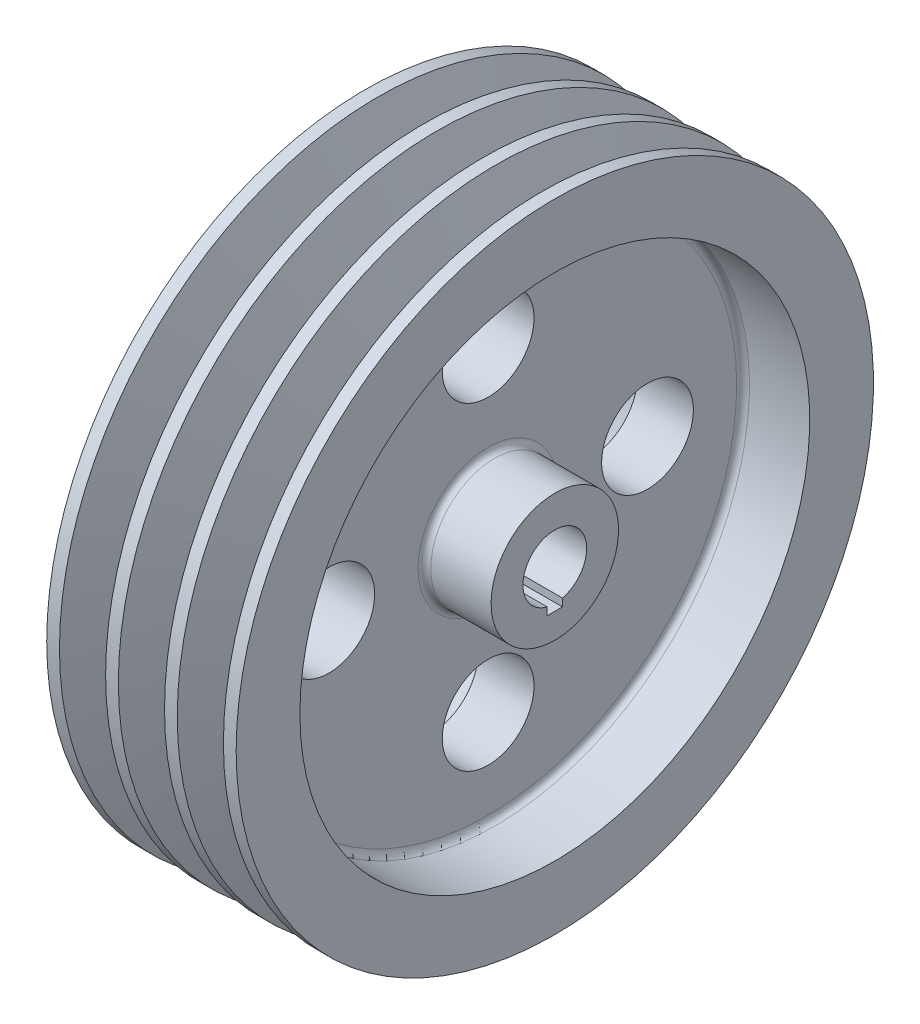
from build123d import *

# Parameters (mm, degrees)
SKETCH5_R          = 18
CUT_EXTRUDE1_DEPTH = 184.21802731
CUT_EXTRUDE2_DEPTH = 192.759733972


with BuildPart() as part:
    # Sketch1 → Revolve1 (revolve)
    with BuildSketch(Plane(origin=(0, 0, 0), x_dir=(1, 0, 0), z_dir=(0, 1, 0)), mode=Mode.PRIVATE) as revolve1_sk:
        with BuildLine():
            Line((0, 125), (0, 100))
            Line((0, 100), (23.65439265, 100))
            ThreePointArc((23.65439265, 100), (25.422159603, 99.267766953), (26.15439265, 97.5))
            Line((26.15439265, 97.5), (26.15439265, 27.5))
            ThreePointArc((26.15439265, 27.5), (25.422159603, 25.732233047), (23.65439265, 25))
            Line((23.65439265, 25), (2.5, 25))
            Line((2.5, 25), (0, 25))
            Line((0, 25), (0, 22.5))
            Line((0, 22.5), (0, 12.5))
            Line((0, 12.5), (74.308785301, 12.5))
            Line((74.308785301, 12.5), (74.308785301, 22.5))
            Line((74.308785301, 22.5), (74.308785301, 25))
            Line((74.308785301, 25), (71.808785301, 25))
            Line((71.808785301, 25), (50.65439265, 25))
            ThreePointArc((50.65439265, 25), (48.886625697, 25.732233047), (48.15439265, 27.5))
            Line((48.15439265, 27.5), (48.15439265, 97.5))
            ThreePointArc((48.15439265, 97.5), (48.886625697, 99.267766953), (50.65439265, 100))
            Line((50.65439265, 100), (74.308785301, 100))
            Line((74.308785301, 100), (74.308785301, 125))
            Line((74.308785301, 125), (69.308785301, 125))
            Line((69.308785301, 125), (62.757321084, 107))
            Line((62.757321084, 107), (57.757321084, 107))
            Line((57.757321084, 107), (51.205856867, 125))
            Line((51.205856867, 125), (46.205856867, 125))
            Line((46.205856867, 125), (39.65439265, 107))
            Line((39.65439265, 107), (34.65439265, 107))
            Line((34.65439265, 107), (28.102928434, 125))
            Line((28.102928434, 125), (23.102928434, 125))
            Line((23.102928434, 125), (16.551464217, 107))
            Line((16.551464217, 107), (11.551464217, 107))
            Line((11.551464217, 107), (5, 125))
            Line((5, 125), (0, 125))
        make_face()
    revolve(revolve1_sk.sketch.rotate(Axis((-67.943978181, 0, 0), (1, 0, 0)), 180), axis=Axis((-67.943978181, 0, 0), (1, 0, 0)))

    # Sketch5 → Cut-Extrude1 (cut, through all)
    with BuildSketch(Plane.ZY.offset(-26.15439265)):
        with Locations((0, 62.5)):
            Circle(SKETCH5_R)
        with Locations((62.5, 0)):
            Circle(SKETCH5_R)
        with Locations((0, -62.5)):
            Circle(SKETCH5_R)
        with Locations((-62.5, 0)):
            Circle(SKETCH5_R)
    extrude(amount=-CUT_EXTRUDE1_DEPTH, mode=Mode.SUBTRACT)

    # Sketch6 → Cut-Extrude2 (cut, through all)
    with BuildSketch(Plane.ZY):
        with BuildLine():
            Line((-3, -12.1346611), (-3, -15.1346611))
            Line((-3, -15.1346611), (3, -15.1346611))
            Line((3, -15.1346611), (3, -12.1346611))
            ThreePointArc((3, -12.1346611), (0, -12.5), (-3, -12.1346611))
        make_face()
    extrude(amount=-CUT_EXTRUDE2_DEPTH, mode=Mode.SUBTRACT)


solid = part.part
